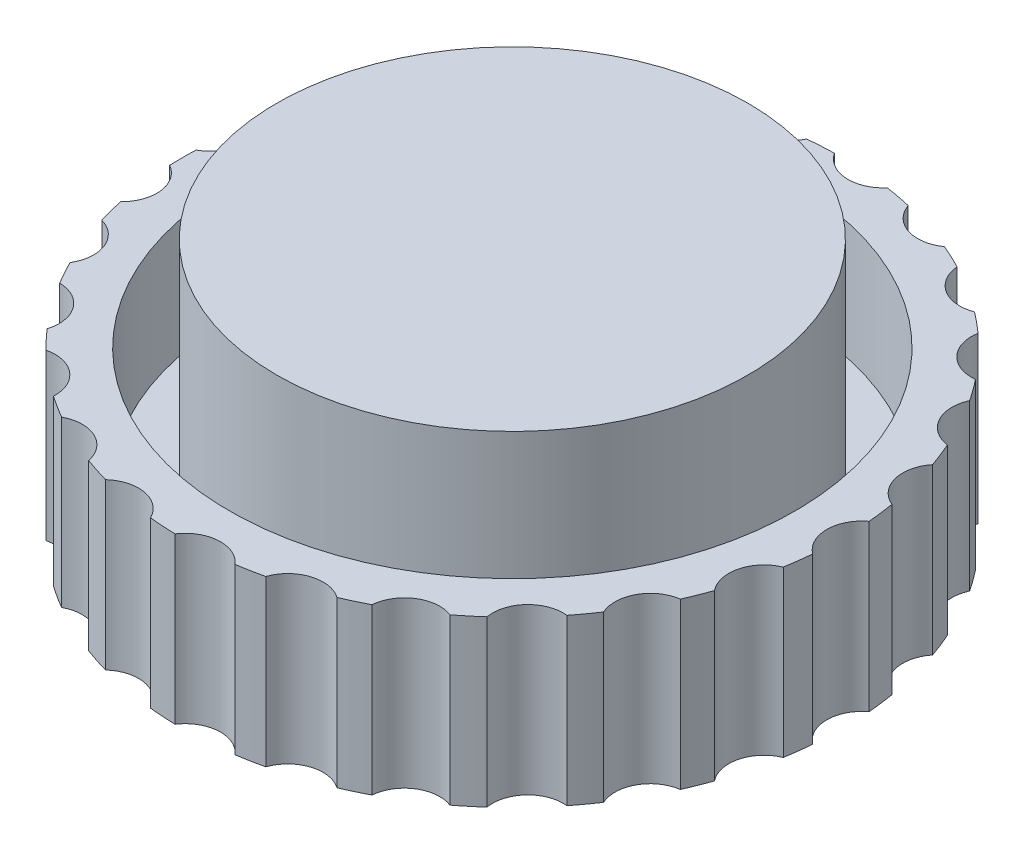
from build123d import *

# Parameters (mm, degrees)
ENL_V_START             = -7
ESQUISSE2_R             = 1.5
ENL_V_MAT_EXTRU_1_DEPTH = 7


with BuildPart() as part:
    # Esquisse1 → Révolution1 (revolve)
    with BuildSketch(Plane.XY, mode=Mode.PRIVATE) as r_volution1_sk:
        Polygon((0, 0), (-14, 0), (-14, 7), (-12, 7), (-12, 2), (-10, 2), (-10, 11), (0, 11), align=None)
    revolve(r_volution1_sk.sketch.rotate(Axis((0, 0, 0), (0, 1, 0)), 270), axis=Axis((0, 0, 0), (0, 1, 0)))

    # Esquisse2 → Enlèv. mat.-Extru.1 (cut)
    with BuildSketch(Plane(origin=(0, 7, 0), x_dir=(1, 0, 0), z_dir=(0, 1, 0)).offset(ENL_V_START)):
        with Locations((14.848980609, 0)):
            Circle(ESQUISSE2_R)
        with Locations((14.382472578, -3.692791312)):
            Circle(ESQUISSE2_R)
        with Locations((13.012260899, -7.153550965)):
            Circle(ESQUISSE2_R)
        with Locations((10.824441013, -10.164826702)):
            Circle(ESQUISSE2_R)
        with Locations((7.956481688, -12.537408993)):
            Circle(ESQUISSE2_R)
        with Locations((4.588587357, -14.122219768)):
            Circle(ESQUISSE2_R)
        with Locations((0.932375207, -14.819679538)):
            Circle(ESQUISSE2_R)
        with Locations((-2.782421507, -14.585964338)):
            Circle(ESQUISSE2_R)
        with Locations((-6.322388444, -13.435759356)):
            Circle(ESQUISSE2_R)
        with Locations((-9.465096463, -11.441336201)):
            Circle(ESQUISSE2_R)
        with Locations((-12.013077662, -8.728011813)):
            Circle(ESQUISSE2_R)
        with Locations((-13.80623301, -5.466274344)):
            Circle(ESQUISSE2_R)
        with Locations((-14.731891962, -1.861070755)):
            Circle(ESQUISSE2_R)
        with Locations((-14.731891962, 1.861070755)):
            Circle(ESQUISSE2_R)
        with Locations((-13.80623301, 5.466274344)):
            Circle(ESQUISSE2_R)
        with Locations((-12.013077662, 8.728011813)):
            Circle(ESQUISSE2_R)
        with Locations((-9.465096463, 11.441336201)):
            Circle(ESQUISSE2_R)
        with Locations((-6.322388444, 13.435759356)):
            Circle(ESQUISSE2_R)
        with Locations((-2.782421507, 14.585964338)):
            Circle(ESQUISSE2_R)
        with Locations((0.932375207, 14.819679538)):
            Circle(ESQUISSE2_R)
        with Locations((4.588587357, 14.122219768)):
            Circle(ESQUISSE2_R)
        with Locations((7.956481688, 12.537408993)):
            Circle(ESQUISSE2_R)
        with Locations((10.824441013, 10.164826702)):
            Circle(ESQUISSE2_R)
        with Locations((13.012260899, 7.153550965)):
            Circle(ESQUISSE2_R)
        with Locations((14.382472578, 3.692791312)):
            Circle(ESQUISSE2_R)
    extrude(amount=ENL_V_MAT_EXTRU_1_DEPTH, mode=Mode.SUBTRACT)


solid = part.part
